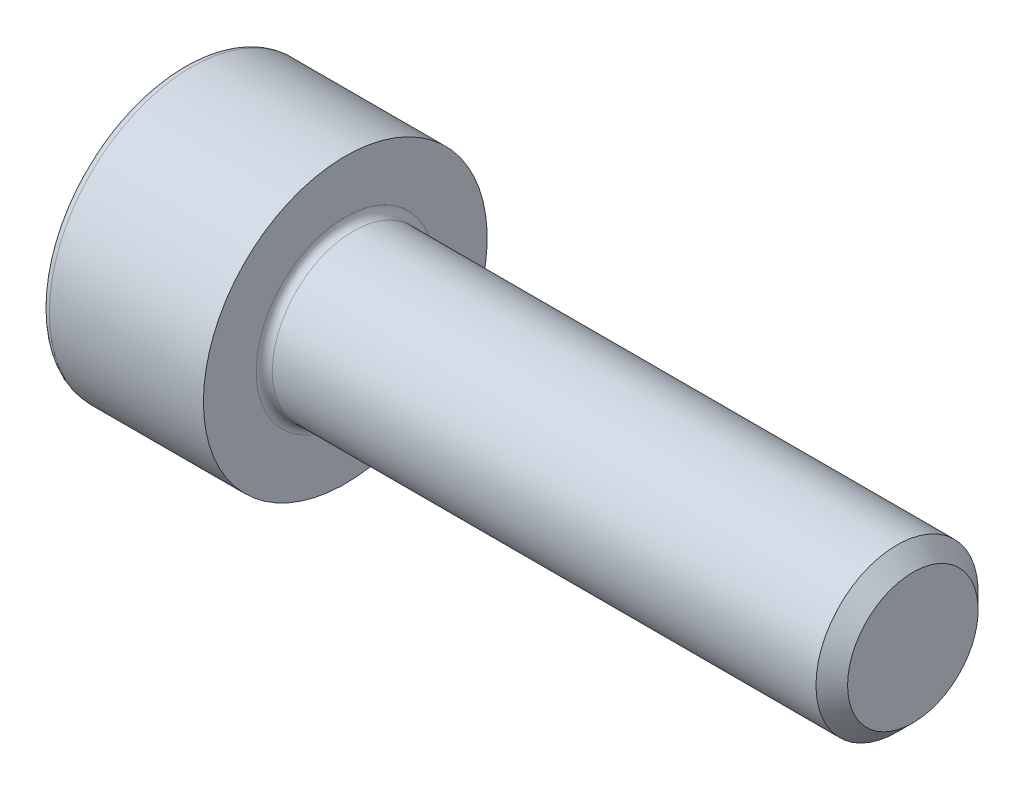
from build123d import *

# Parameters (mm, degrees)
ESQUISSE1_W             = 4
ESQUISSE1_H             = 3.5
ESQUISSE2_R             = 2
BOSS_EXTRU_1_DEPTH      = 14
ENL_V_MAT_EXTRU_1_DEPTH = 2
CHANFREIN1_SIZE         = 0.39
CONG_1_R                = 0.2


with BuildPart() as part:
    # Esquisse1 → Révolution1 (revolve)
    with BuildSketch(Plane(origin=(0, 0, 0), x_dir=(-1, 0, 0), z_dir=(0, 0, -1)), mode=Mode.PRIVATE) as r_volution1_sk:
        with Locations((-2, 1.75)):
            Rectangle(ESQUISSE1_W, ESQUISSE1_H)
    revolve(r_volution1_sk.sketch.rotate(Axis((4, 0, 0), (-1, 0, 0)), 270), axis=Axis((4, 0, 0), (-1, 0, 0)))

    # Esquisse2 → Boss.-Extru.1 (add)
    with BuildSketch(Plane(origin=(4, 0, 0), x_dir=(0, 0, -1), z_dir=(1, 0, 0))):
        with Locations(Location((0, 0, 0), (0, 0, 180))):
            Circle(ESQUISSE2_R)
    extrude(amount=BOSS_EXTRU_1_DEPTH)

    # Esquisse3 → Enlèv. mat.-Extru.1 (cut)
    with BuildSketch(Plane.ZY):
        Polygon((0, -1.773042677), (1.5355, -0.886521338), (1.5355, 0.886521338), (0, 1.773042677), (-1.5355, 0.886521338), (-1.5355, -0.886521338), align=None)
    extrude(amount=-ENL_V_MAT_EXTRU_1_DEPTH, mode=Mode.SUBTRACT)

    # Esquisse4 → Enlèvement de matière-Révolution1 (revolve, cut)
    with BuildSketch(Plane.XY, mode=Mode.PRIVATE) as enl_vement_de_mati_re_r_volution1_sk:
        Polygon((2, 1.5355), (2, 0), (2.886521338, 0), align=None)
    revolve(enl_vement_de_mati_re_r_volution1_sk.sketch.rotate(Axis((2, 0, 0), (1, 0, 0)), 90), axis=Axis((2, 0, 0), (1, 0, 0)), mode=Mode.SUBTRACT)

    # Chanfrein1
    chanfrein1_edges = [part.edges().sort_by_distance(p)[0] for p in [
        (18, 0, -2),
    ]]
    chamfer(chanfrein1_edges, length=CHANFREIN1_SIZE)

    # Congé1
    cong_1_edges = [part.edges().sort_by_distance(p)[0] for p in [
        (0, 0, -3.5),
        (4, 0, -2),
    ]]
    fillet(cong_1_edges, radius=CONG_1_R)


solid = part.part
